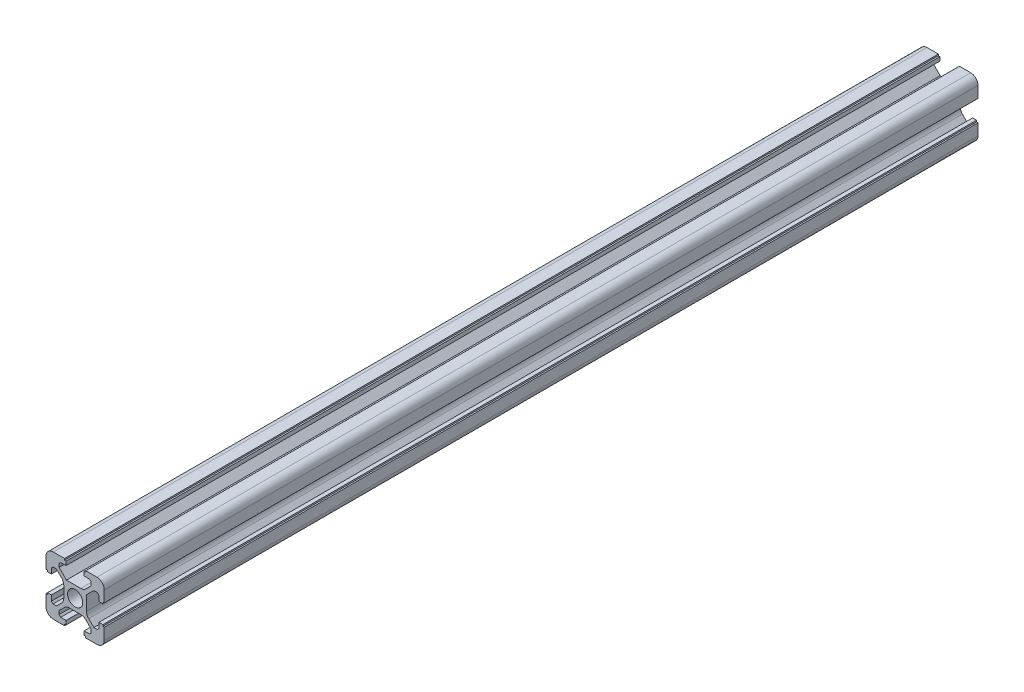
from build123d import *

# Parameters (mm, degrees)
SKETCH1_W           = 16.3
SKETCH1_H           = 16.3
SKETCH1_W_2         = 11
SKETCH1_H_2         = 11
SKETCH1_R           = 2.6
BOSS_EXTRUDE1_DEPTH = 300
CUT_EXTRUDE2_DEPTH  = 301.333148354
FILLET1_R           = 2.5
FILLET2_R           = 2.5
SKETCH3_W           = 1
SKETCH3_H           = 7.25
SKETCH3_W_2         = 7.25
SKETCH3_H_2         = 1
CUT_EXTRUDE3_DEPTH  = 301.333148354


with BuildPart() as part:
    # Sketch1 → Boss-Extrude1 (new body)
    # profile 1 of 6: a face of its own
    with BuildSketch(Plane.XY):
        Polygon((-3.1, 8.15), (-3.1, 10), (-10, 10), (-10, 3.1), (-8.15, 3.1), (-8.15, 8.15), align=None)
    # profile 2 of 6: a face of its own
    with BuildSketch(Plane.XY):
        Polygon((10, 10), (3.1, 10), (3.1, 8.15), (8.15, 8.15), (8.15, 3.1), (10, 3.1), align=None)
    # profile 3 of 6: a face of its own
    with BuildSketch(Plane.XY):
        Rectangle(SKETCH1_W, SKETCH1_H)
        Rectangle(SKETCH1_W_2, SKETCH1_H_2, mode=Mode.SUBTRACT)
    # profile 4 of 6: a face of its own
    with BuildSketch(Plane.XY):
        Polygon((10, -10), (10, -3.1), (8.15, -3.1), (8.15, -8.15), (3.1, -8.15), (3.1, -10), align=None)
    # profile 5 of 6: a face of its own
    with BuildSketch(Plane.XY):
        Polygon((-8.15, -3.1), (-10, -3.1), (-10, -10), (-3.1, -10), (-3.1, -8.15), (-8.15, -8.15), align=None)
    # profile 6 of 6: a face of its own
    with BuildSketch(Plane.XY):
        Rectangle(SKETCH1_W_2, SKETCH1_H_2)
        Circle(SKETCH1_R, mode=Mode.SUBTRACT)
    extrude(amount=BOSS_EXTRUDE1_DEPTH)

    # Sketch2 → Cut-Extrude2 (cut, through all)
    with BuildSketch(Plane.XY.offset(300)):
        Polygon((-5.5, -4.580761184), (-5.5, 4.580761184), (-6.419238816, 5.5), (-7.6, 5.5), (-8.15, 4.95), (-8.15, 3.1), (-8.15, -3.1), (-8.15, -4.95), (-7.6, -5.5), (-6.419238816, -5.5), align=None)
        Polygon((-3.9, -2.980761184), (-3.9, 2.980761184), (-5.5, 4.580761184), (-5.5, -4.580761184), align=None)
        Polygon((-5.5, 6.419238816), (-4.580761184, 5.5), (4.580761184, 5.5), (5.5, 6.419238816), (5.5, 7.6), (4.95, 8.15), (3.1, 8.15), (-3.1, 8.15), (-4.95, 8.15), (-5.5, 7.6), align=None)
        Polygon((-4.580761184, 5.5), (-2.980761184, 3.9), (2.980761184, 3.9), (4.580761184, 5.5), align=None)
        Polygon((6.419238816, 5.5), (5.5, 4.580761184), (5.5, -4.580761184), (6.419238816, -5.5), (7.6, -5.5), (8.15, -4.95), (8.15, -3.1), (8.15, 3.1), (8.15, 4.95), (7.6, 5.5), align=None)
        Polygon((5.5, 4.580761184), (3.9, 2.980761184), (3.9, -2.980761184), (5.5, -4.580761184), align=None)
        Polygon((4.580761184, -5.5), (-4.580761184, -5.5), (-5.5, -6.419238816), (-5.5, -7.6), (-4.95, -8.15), (-3.1, -8.15), (3.1, -8.15), (4.95, -8.15), (5.5, -7.6), (5.5, -6.419238816), align=None)
        Polygon((2.980761184, -3.9), (-2.980761184, -3.9), (-4.580761184, -5.5), (4.580761184, -5.5), align=None)
    extrude(amount=-CUT_EXTRUDE2_DEPTH, mode=Mode.SUBTRACT)

    # Fillet1
    fillet1_edges = [part.edges().sort_by_distance(p)[0] for p in [
        (-10, -10, 150),
        (-10, 10, 150),
        (10, 10, 150),
        (10, -10, 150),
    ]]
    fillet(fillet1_edges, radius=FILLET1_R)

    # Fillet2
    fillet2_edges = [part.edges().sort_by_distance(p)[0] for p in [
        (2.980761184, 3.9, 150),
        (3.9, -2.980761184, 150),
        (-2.980761184, -3.9, 150),
        (2.980761184, -3.9, 150),
        (-3.9, 2.980761184, 150),
        (-3.9, -2.980761184, 150),
    ]]
    fillet(fillet2_edges, radius=FILLET2_R)

    # Sketch3 → Cut-Extrude3 (cut, through all)
    with BuildSketch(Plane.XY.offset(300)):
        with Locations((10, 0)):
            Rectangle(SKETCH3_W, SKETCH3_H)
        with Locations((0, 10)):
            Rectangle(SKETCH3_W_2, SKETCH3_H_2)
        with Locations((0, -10)):
            Rectangle(SKETCH3_W_2, SKETCH3_H_2)
        with Locations((-10, 0)):
            Rectangle(SKETCH3_W, SKETCH3_H)
    extrude(amount=-CUT_EXTRUDE3_DEPTH, mode=Mode.SUBTRACT)


solid = part.part
